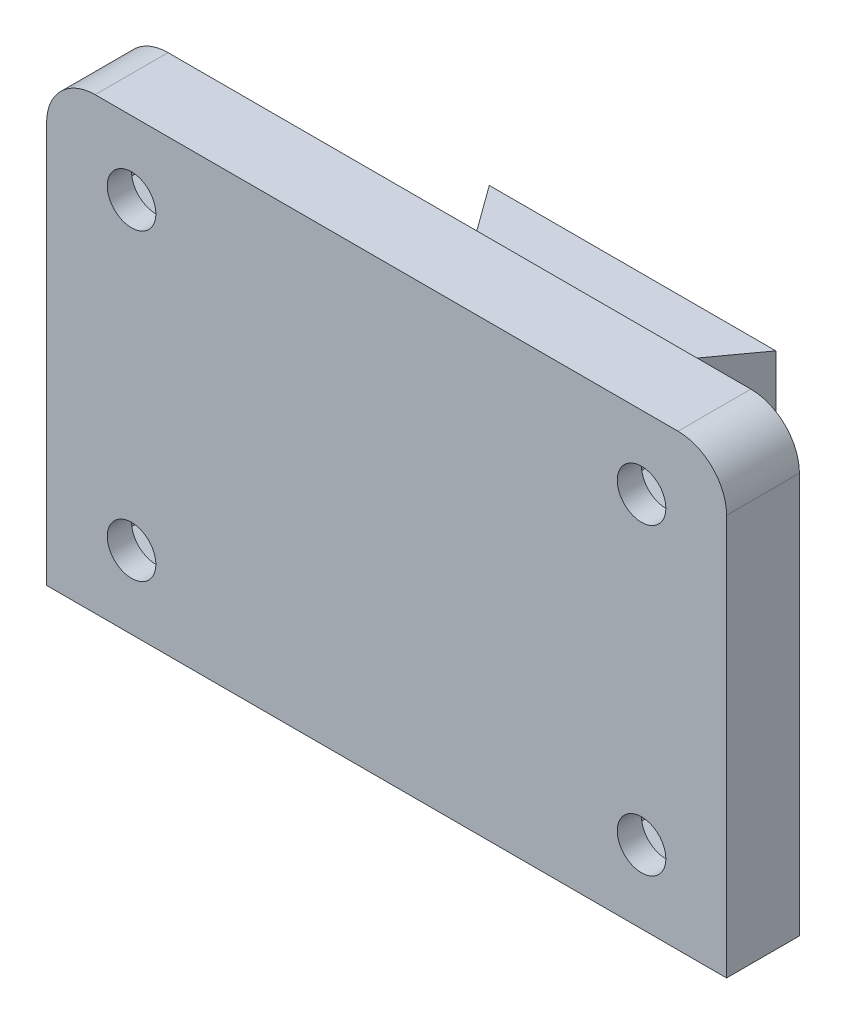
from build123d import *

# Parameters (mm, degrees)
DOVETAIL_DEPTH     = 8
SKETCH2_W          = 3.35034124
SKETCH2_H          = 8
STEM_DEPTH         = 3
SKETCH3_W          = 28
SKETCH3_H          = 18.5
CAMERA_PLATE_DEPTH = 3
FILLET1_R          = 2
SKETCH4_R          = 1
SCREW_HOLES_DEPTH  = 3
NUT_HOLES_DEPTH    = 2
FILLET2_R          = 2


with BuildPart() as part:
    # Sketch1 → Dovetail (new body)
    with BuildSketch(Plane(origin=(0, 0, 0), x_dir=(1, 0, 0), z_dir=(0, 1, 0))):
        Polygon((-2.9, 0), (-5.9, 4.129145761), (5.9, 4.129145761), (2.9, 0), align=None)
    extrude(amount=DOVETAIL_DEPTH)

    # Sketch2 → Stem (add)
    with BuildSketch(Plane.XY):
        with Locations((0, 4)):
            Rectangle(SKETCH2_W, SKETCH2_H)
    extrude(amount=STEM_DEPTH)

    # Sketch3 → Camera Plate (add)
    with BuildSketch(Plane.XY.offset(3)):
        with Locations((0, 4)):
            Rectangle(SKETCH3_W, SKETCH3_H)
    extrude(amount=CAMERA_PLATE_DEPTH)

    # Fillet1
    fillet1_edges = [part.edges().sort_by_distance(p)[0] for p in [
        (1.67517062, 4, 3),
        (0, 8, 3),
        (-1.67517062, 4, 3),
        (0, 0, 3),
    ]]
    fillet(fillet1_edges, radius=FILLET1_R)

    # Sketch4 → Screw Holes (cut)
    with BuildSketch(Plane.XY.offset(6)):
        with Locations((-10.5, 10.25)):
            Circle(SKETCH4_R)
        with Locations((10.5, 10.25)):
            Circle(SKETCH4_R)
        with Locations((10.5, -2.25)):
            Circle(SKETCH4_R)
        with Locations((-10.5, -2.25)):
            Circle(SKETCH4_R)
    extrude(amount=-SCREW_HOLES_DEPTH, mode=Mode.SUBTRACT)

    # Sketch5 → Nut Holes (cut)
    with BuildSketch(Plane(origin=(0, 0, 3), x_dir=(-1, 0, 0), z_dir=(0, 0, -1))):
        Polygon((-10.5, 12.559401077), (-12.5, 11.404700538), (-12.5, 9.095299462), (-10.5, 7.940598923), (-8.5, 9.095299462), (-8.5, 11.404700538), align=None)
        Polygon((10.5, 12.559401077), (8.5, 11.404700538), (8.5, 9.095299462), (10.5, 7.940598923), (12.5, 9.095299462), (12.5, 11.404700538), align=None)
        Polygon((-10.5, -4.559401077), (-8.5, -3.404700538), (-8.5, -1.095299462), (-10.5, 0.059401077), (-12.5, -1.095299462), (-12.5, -3.404700538), align=None)
        Polygon((10.5, -4.559401077), (12.5, -3.404700538), (12.5, -1.095299462), (10.5, 0.059401077), (8.5, -1.095299462), (8.5, -3.404700538), align=None)
    extrude(amount=-NUT_HOLES_DEPTH, mode=Mode.SUBTRACT)

    # Fillet2
    fillet2_edges = [part.edges().sort_by_distance(p)[0] for p in [
        (14, 13.25, 4.5),
        (-14, 13.25, 4.5),
    ]]
    fillet(fillet2_edges, radius=FILLET2_R)


solid = part.part
